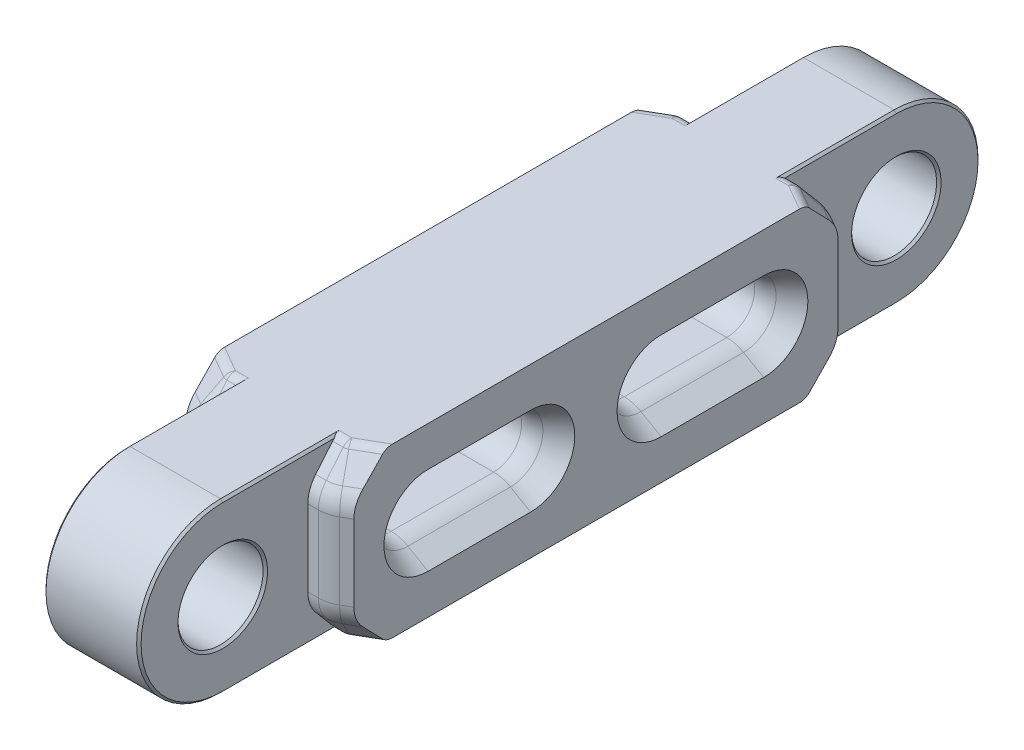
from build123d import *
from OCP.BRepFilletAPI import BRepFilletAPI_MakeChamfer

# Parameters (mm, degrees)
BOSS_EXTRUDE1_DEPTH = 8.5
BOSS_EXTRUDE2_DEPTH = 15
CHAMFER8_SIZE       = 3
CHAMFER8_SIZE2      = 1.732050808
FILLET6_R           = 6
CHAMFER9_SIZE       = 6
CHAMFER9_SIZE2      = 5.034597787
FILLET7_R           = 6
CHAMFER10_SIZE      = 5
CHAMFER10_SIZE2     = 2.886751346
FILLET8_R           = 6
FILLET9_R           = 2
CHAMFER11_SIZE      = 0.4


with BuildPart() as part:
    # Sketch1 → Boss-Extrude1 (new body)
    with BuildSketch(Plane.YZ):
        with BuildLine():
            ThreePointArc((0, -7.6), (-7.6, 0), (0, 7.6))
            Line((0, 7.6), (0, 15))
            ThreePointArc((0, 15), (-10.606601718, 10.606601718), (-15, 0))
            Line((-15, 0), (-15, -60.2))
            Line((-15, -60.2), (0, -60.2))
            Line((0, -60.2), (0, -53.533333333))
            ThreePointArc((0, -53.533333333), (-3.535533906, -52.068867239), (-5, -48.533333333))
            Line((-5, -48.533333333), (-5, -30.2))
            ThreePointArc((-5, -30.2), (-3.535533906, -26.664466094), (0, -25.2))
            Line((0, -25.2), (0, -7.6))
        make_face()
    extrude(amount=BOSS_EXTRUDE1_DEPTH)

    # Sketch1<4> → Boss-Extrude2 (add)
    with BuildSketch(Plane.YZ):
        with BuildLine():
            Line((0, -15.2), (-15, -15.2))
            Line((-15, -15.2), (-15, -60.2))
            Line((-15, -60.2), (0, -60.2))
            Line((0, -60.2), (0, -53.533333333))
            ThreePointArc((0, -53.533333333), (-3.535533906, -52.068867239), (-5, -48.533333333))
            Line((-5, -48.533333333), (-5, -30.2))
            ThreePointArc((-5, -30.2), (-3.535533906, -26.664466094), (0, -25.2))
            Line((0, -25.2), (0, -15.2))
        make_face()
    extrude(amount=BOSS_EXTRUDE2_DEPTH)

    # Chamfer8
    chamfer8_edges = [part.edges().sort_by_distance(p)[0] for p in [
        (15, -7.5, -15.2),
    ]]
    chamfer8_side = [part.faces().sort_by_distance(p)[0] for p in [
        (11.75, -7.5, -15.2),
    ]]
    chamfer(chamfer8_edges, length=CHAMFER8_SIZE, length2=CHAMFER8_SIZE2, reference=chamfer8_side[0])

    # Fillet6
    fillet6_edges = [part.edges().sort_by_distance(p)[0] for p in [
        (12, -7.5, -15.2),
    ]]
    fillet(fillet6_edges, radius=FILLET6_R)

    # Chamfer9: one chamfer whose edges measure the first distance from different faces: ONE call of the kernel's chamfer builder (chamfer() names one face for all edges)
    chamfer9_edges_1 = [part.edges().sort_by_distance(p)[0] for p in [
        (14.196152423, -15, -16.467949192),
    ]]
    chamfer9_side_1 = [part.faces().sort_by_distance(p)[0] for p in [
        (14.196152423, -7.5, -16.467949192),
    ]]
    chamfer9_edges_2 = [part.edges().sort_by_distance(p)[0] for p in [
        (11.945219116, -15, -15.404445042),
    ]]
    chamfer9_side_2 = [part.faces().sort_by_distance(p)[0] for p in [
        (11.945219116, -7.5, -15.404445042),
    ]]
    chamfer9_edges_3 = [part.edges().sort_by_distance(p)[0] for p in [
        (9.446152423, -15, -15.2),
    ]]
    chamfer9_side_3 = [part.faces().sort_by_distance(p)[0] for p in [
        (9.446152423, -7.5, -15.2),
    ]]
    chamfer9 = BRepFilletAPI_MakeChamfer(part.part.solid().wrapped)
    for e in chamfer9_edges_1:
        chamfer9.Add(CHAMFER9_SIZE, CHAMFER9_SIZE2, e.wrapped, chamfer9_side_1[0].wrapped)  # the first distance lies on this face
    for e in chamfer9_edges_2:
        chamfer9.Add(CHAMFER9_SIZE, CHAMFER9_SIZE2, e.wrapped, chamfer9_side_2[0].wrapped)  # the first distance lies on this face
    for e in chamfer9_edges_3:
        chamfer9.Add(CHAMFER9_SIZE, CHAMFER9_SIZE2, e.wrapped, chamfer9_side_3[0].wrapped)  # the first distance lies on this face
    add(Compound.cast(chamfer9.Shape()), mode=Mode.REPLACE)

    # Fillet7
    fillet7_edges = [part.edges().sort_by_distance(p)[0] for p in [
        (14.196152423, -9, -16.467949192),
        (11.945219116, -9, -15.404445042),
        (9.446152423, -9, -15.2),
    ]]
    fillet(fillet7_edges, radius=FILLET7_R)

    # Chamfer10: one chamfer whose edges measure the first distance from different faces: ONE call of the kernel's chamfer builder (chamfer() names one face for all edges)
    chamfer10_edges_1 = [part.edges().sort_by_distance(p)[0] for p in [
        (15, -3.535533906, -52.068867239),
    ]]
    chamfer10_side_1 = [part.faces().sort_by_distance(p)[0] for p in [
        (7.5, -3.535533906, -52.068867239),
    ]]
    chamfer10_edges_2 = [part.edges().sort_by_distance(p)[0] for p in [
        (15, -5, -39.366666667),
    ]]
    chamfer10_side_2 = [part.faces().sort_by_distance(p)[0] for p in [
        (7.5, -5, -39.366666667),
    ]]
    chamfer10_edges_3 = [part.edges().sort_by_distance(p)[0] for p in [
        (15, -3.535533906, -26.664466094),
    ]]
    chamfer10_side_3 = [part.faces().sort_by_distance(p)[0] for p in [
        (7.5, -3.535533906, -26.664466094),
    ]]
    chamfer10 = BRepFilletAPI_MakeChamfer(part.part.solid().wrapped)
    for e in chamfer10_edges_1:
        chamfer10.Add(CHAMFER10_SIZE, CHAMFER10_SIZE2, e.wrapped, chamfer10_side_1[0].wrapped)  # the first distance lies on this face
    for e in chamfer10_edges_2:
        chamfer10.Add(CHAMFER10_SIZE, CHAMFER10_SIZE2, e.wrapped, chamfer10_side_2[0].wrapped)  # the first distance lies on this face
    for e in chamfer10_edges_3:
        chamfer10.Add(CHAMFER10_SIZE, CHAMFER10_SIZE2, e.wrapped, chamfer10_side_3[0].wrapped)  # the first distance lies on this face
    add(Compound.cast(chamfer10.Shape()), mode=Mode.REPLACE)

    # Fillet8
    fillet8_edges = [part.edges().sort_by_distance(p)[0] for p in [
        (10, -3.535533906, -52.068867239),
        (10, -5, -39.366666667),
        (10, -3.535533906, -26.664466094),
    ]]
    fillet(fillet8_edges, radius=FILLET8_R)

    # Fillet9
    fillet9_edges = [part.edges().sort_by_distance(p)[0] for p in [
        (9.446152423, -15, -20.234597787),
        (10.642169324, -15, -20.26749307),
        (12.937502976, -15, -21.554720371),
    ]]
    fillet(fillet9_edges, radius=FILLET9_R)

    # Chamfer11
    chamfer11_edges = [part.edges().sort_by_distance(p)[0] for p in [
        (8.5, -7.6, 0),
        (8.5, -15, -10.583606552),
        (8.5, -10.606601718, 10.606601718),
    ]]
    chamfer(chamfer11_edges, length=CHAMFER11_SIZE)

    # Mirror1: part across plane


with BuildPart() as part_1:
    add(part.part)
    add(part.part.mirror(Plane(origin=(8.5, 0, 0), x_dir=(0, 0, 1), z_dir=(0, 1, 0))))

    # Mirror2: part across plane


with BuildPart() as part_2:
    add(part_1.part)
    add(part_1.part.mirror(Plane(origin=(8.5, 0, -60.2), x_dir=(1, 0, 0), z_dir=(0, 0, 1))))

    # Mirror3: part across plane


with BuildPart() as part_3:
    add(part_2.part)
    add(part_2.part.mirror(Plane(origin=(0, 0, 0), x_dir=(0, 0, 1), z_dir=(1, 0, 0))))


solid = part_3.part
